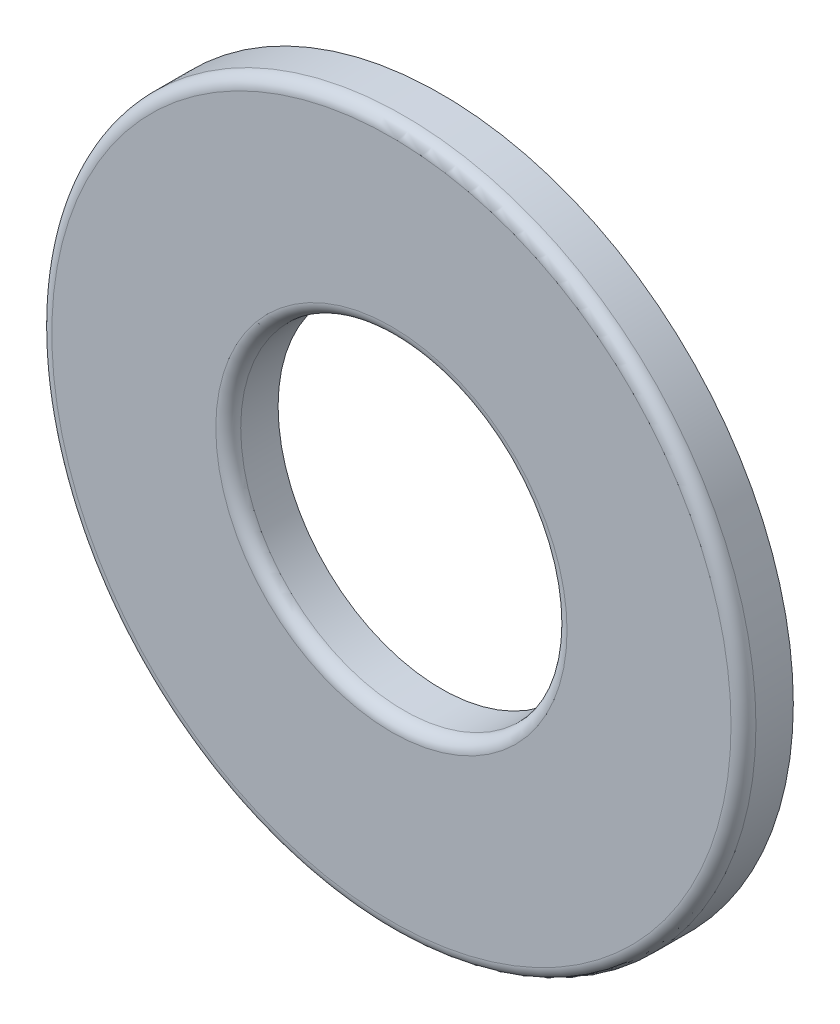
from build123d import *

# Parameters (mm, degrees)
BOSS_EXTRUDE1_DEPTH      = 0.3937
BOSS_EXTRUDE1_DEPTH_BACK = 0.3937
SKETCH3_R                = 5.5626
SKETCH3_R_2              = 2.5781
FILLET1_R                = 0.19685


with BuildPart() as part:
    # Sketch3 → Boss-Extrude1 (new, two sides: drawn at the far end of the back side and taken through both)
    with BuildSketch(Plane.XY.offset(-BOSS_EXTRUDE1_DEPTH_BACK)):
        with Locations(Location((0, 0, 0), (0, 0, 180))):
            Circle(SKETCH3_R)
        with Locations(Location((0, 0, 0), (0, 0, 180))):
            Circle(SKETCH3_R_2, mode=Mode.SUBTRACT)
    extrude(amount=BOSS_EXTRUDE1_DEPTH + BOSS_EXTRUDE1_DEPTH_BACK)

    # Fillet1
    fillet1_edges = [part.edges().sort_by_distance(p)[0] for p in [
        (5.5626, 0, 0.3937),
        (2.5781, 0, 0.3937),
    ]]
    fillet(fillet1_edges, radius=FILLET1_R)


solid = part.part
